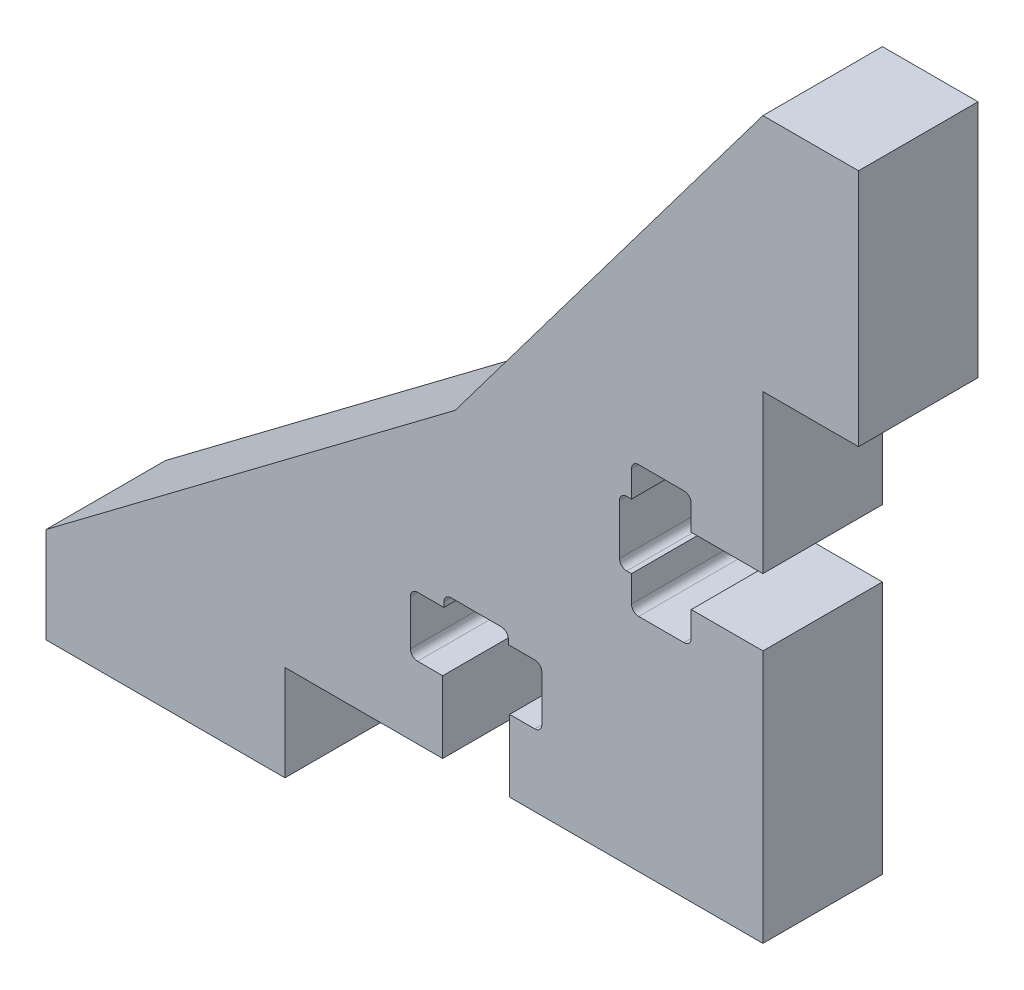
from build123d import *

# Parameters (mm, degrees)
EXTRUDE_1_DEPTH     = 5
CUT_EXTRUDE_1_DEPTH = 10
SKETCH_3_W          = 10
SKETCH_3_H          = 5
EXTRUDE_2_DEPTH     = 5
SKETCH_4_W          = 5
SKETCH_4_H          = 10
EXTRUDE_3_DEPTH     = 5
SKETCH_5_W          = 10
SKETCH_5_H          = 5
CUT_EXTRUDE_2_DEPTH = 1
SKETCH_6_W          = 5
SKETCH_6_H          = 10
CUT_EXTRUDE_3_DEPTH = 1
CUT_EXTRUDE_5_DEPTH = 5


with BuildPart() as part:
    # 草图1 → 凸台-拉伸1 (new body)
    with BuildSketch(Plane.XY):
        Polygon((0, 0), (30, 0), (30, 30), align=None)
    extrude(amount=EXTRUDE_1_DEPTH)

    # 草图2 → 切除-拉伸1 (cut)
    with BuildSketch(Plane.XY.offset(5)):
        Polygon((17.121320344, 12.878679656), (15, 15), (0, 0), align=None)
        Polygon((17.121320344, 12.878679656), (30, 30), (15, 15), align=None)
    extrude(amount=-CUT_EXTRUDE_1_DEPTH, mode=Mode.SUBTRACT)

    # 草图3 → 凸台-拉伸2 (add)
    with BuildSketch(Plane.XZ):
        with Locations((5, 2.5)):
            Rectangle(SKETCH_3_W, SKETCH_3_H)
    extrude(amount=EXTRUDE_2_DEPTH)

    # 草图4 → 凸台-拉伸3 (add)
    with BuildSketch(Plane(origin=(30, 0, 0), x_dir=(0, 0, -1), z_dir=(1, 0, 0))):
        with Locations((-2.5, 25)):
            Rectangle(SKETCH_4_W, SKETCH_4_H)
    extrude(amount=EXTRUDE_3_DEPTH)

    # 草图5 → 切除-拉伸2 (cut)
    with BuildSketch(Plane.XZ.offset(5)):
        with Locations((5, 2.5)):
            Rectangle(SKETCH_5_W, SKETCH_5_H)
    extrude(amount=-CUT_EXTRUDE_2_DEPTH, mode=Mode.SUBTRACT)

    # 草图6 → 切除-拉伸3 (cut)
    with BuildSketch(Plane(origin=(35, 0, 0), x_dir=(0, 0, -1), z_dir=(1, 0, 0))):
        with Locations((-2.5, 25)):
            Rectangle(SKETCH_6_W, SKETCH_6_H)
    extrude(amount=-CUT_EXTRUDE_3_DEPTH, mode=Mode.SUBTRACT)

    # 草图8 → 切除-拉伸5 (cut)
    with BuildSketch(Plane(origin=(-129.723125666, 239.943153128, 0), x_dir=(0, 1, 0), z_dir=(0, 0, -1))):
        with BuildLine():
            Line((-229.343153128, 156.723125666), (-229.343153128, 159.223125666))
            Line((-229.343153128, 159.223125666), (-229.343153128, 161.223125666))
            Line((-229.343153128, 161.223125666), (-226.543153128, 161.223125666))
            Line((-226.543153128, 161.223125666), (-226.543153128, 159.223125666))
            Line((-226.543153128, 159.223125666), (-226.543153128, 156.723125666))
            Line((-226.543153128, 156.723125666), (-225.493153128, 156.723125666))
            ThreePointArc((-225.493153128, 156.723125666), (-225.281021094, 156.6352577), (-225.193153128, 156.423125666))
            Line((-225.193153128, 156.423125666), (-225.193153128, 154.523125666))
            ThreePointArc((-225.193153128, 154.523125666), (-225.281021094, 154.310993631), (-225.493153128, 154.223125666))
            Line((-225.493153128, 154.223125666), (-226.593153128, 154.223125666))
            Line((-226.593153128, 154.223125666), (-226.593153128, 154.023125666))
            ThreePointArc((-226.593153128, 154.023125666), (-226.681021094, 153.810993631), (-226.893153128, 153.723125666))
            Line((-226.893153128, 153.723125666), (-228.993153128, 153.723125666))
            ThreePointArc((-228.993153128, 153.723125666), (-229.205285163, 153.810993631), (-229.293153128, 154.023125666))
            Line((-229.293153128, 154.023125666), (-229.293153128, 154.223125666))
            Line((-229.293153128, 154.223125666), (-230.393153128, 154.223125666))
            ThreePointArc((-230.393153128, 154.223125666), (-230.605285163, 154.310993631), (-230.693153128, 154.523125666))
            Line((-230.693153128, 154.523125666), (-230.693153128, 156.423125666))
            ThreePointArc((-230.693153128, 156.423125666), (-230.605285163, 156.6352577), (-230.393153128, 156.723125666))
            Line((-230.393153128, 156.723125666), (-229.343153128, 156.723125666))
        make_face()
        with BuildLine():
            Line((-239.443153128, 149.123125666), (-236.943153128, 149.123125666))
            Line((-236.943153128, 149.123125666), (-236.943153128, 150.173125666))
            ThreePointArc((-236.943153128, 150.173125666), (-236.855285163, 150.3852577), (-236.643153128, 150.473125666))
            Line((-236.643153128, 150.473125666), (-234.743153128, 150.473125666))
            ThreePointArc((-234.743153128, 150.473125666), (-234.531021094, 150.3852577), (-234.443153128, 150.173125666))
            Line((-234.443153128, 150.173125666), (-234.443153128, 149.073125666))
            Line((-234.443153128, 149.073125666), (-234.243153128, 149.073125666))
            ThreePointArc((-234.243153128, 149.073125666), (-234.031021094, 148.9852577), (-233.943153128, 148.773125666))
            Line((-233.943153128, 148.773125666), (-233.943153128, 146.673125666))
            ThreePointArc((-233.943153128, 146.673125666), (-234.031021094, 146.460993631), (-234.243153128, 146.373125666))
            Line((-234.243153128, 146.373125666), (-234.443153128, 146.373125666))
            Line((-234.443153128, 146.373125666), (-234.443153128, 145.273125666))
            ThreePointArc((-234.443153128, 145.273125666), (-234.531021094, 145.060993631), (-234.743153128, 144.973125666))
            Line((-234.743153128, 144.973125666), (-236.643153128, 144.973125666))
            ThreePointArc((-236.643153128, 144.973125666), (-236.855285163, 145.060993631), (-236.943153128, 145.273125666))
            Line((-236.943153128, 145.273125666), (-236.943153128, 146.323125666))
            Line((-236.943153128, 146.323125666), (-239.443153128, 146.323125666))
            Line((-239.443153128, 146.323125666), (-241.443153128, 146.323125666))
            Line((-241.443153128, 146.323125666), (-241.443153128, 149.123125666))
            Line((-241.443153128, 149.123125666), (-239.443153128, 149.123125666))
        make_face()
    extrude(amount=-CUT_EXTRUDE_5_DEPTH, mode=Mode.SUBTRACT)


solid = part.part
